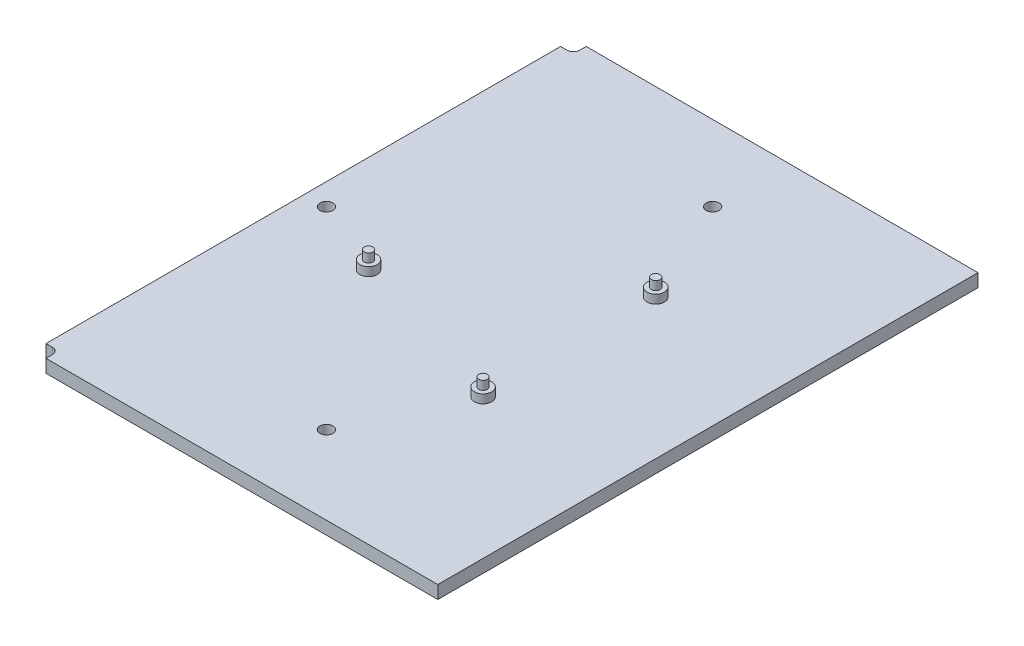
from build123d import *

# Parameters (mm, degrees)
SKETCH1_W           = 93.25
SKETCH1_H           = 124.5
BOSS_EXTRUDE1_DEPTH = 3
SKETCH2_R           = 1.45
CUT_EXTRUDE1_DEPTH  = 78.832853764
SKETCH6_R           = 2
SKETCH6_R_2         = 1
BOSS_EXTRUDE4_DEPTH = 2
SKETCH7_R           = 1
BOSS_EXTRUDE5_DEPTH = 4
SKETCH8_R           = 1.5
CUT_EXTRUDE2_DEPTH  = 3
CUT_EXTRUDE3_DEPTH  = 3
CUT_EXTRUDE4_DEPTH  = 3


with BuildPart() as part:
    # Sketch1 → Boss-Extrude1 (new body)
    with BuildSketch(Plane(origin=(0, 0, 0), x_dir=(1, 0, 0), z_dir=(0, 1, 0))):
        Rectangle(SKETCH1_W, SKETCH1_H)
    extrude(amount=BOSS_EXTRUDE1_DEPTH)

    # Sketch2 → Cut-Extrude1 (cut, through all)
    with BuildSketch(Plane(origin=(0, 3, 0), x_dir=(1, 0, 0), z_dir=(0, 1, 0))):
        with Locations(Location((-45.125, 60.75, 0), (0, 0, 270))):
            Circle(SKETCH2_R)
        with Locations(Location((-45.125, -60.75, 0), (0, 0, 270))):
            Circle(SKETCH2_R)
    extrude(amount=-CUT_EXTRUDE1_DEPTH, mode=Mode.SUBTRACT)

    # Sketch6 → Boss-Extrude4 (add)
    # profile 1 of 3: a face of its own
    with BuildSketch(Plane(origin=(0, 3, 0), x_dir=(1, 0, 0), z_dir=(0, 1, 0))):
        with Locations(Location((-24.225, -7.367286263, 0), (0, 0, 90))):
            Circle(SKETCH6_R)
        with Locations(Location((-24.225, -7.367286263, 0), (0, 0, 270))):
            Circle(SKETCH6_R_2, mode=Mode.SUBTRACT)
    # profile 2 of 3: a face of its own
    with BuildSketch(Plane(origin=(0, 3, 0), x_dir=(1, 0, 0), z_dir=(0, 1, 0))):
        with Locations(Location((14.375, 20.232713737, 0), (0, 0, 90))):
            Circle(SKETCH6_R)
        with Locations(Location((14.375, 20.232713737, 0), (0, 0, 270))):
            Circle(SKETCH6_R_2, mode=Mode.SUBTRACT)
    # profile 3 of 3: a face of its own
    with BuildSketch(Plane(origin=(0, 3, 0), x_dir=(1, 0, 0), z_dir=(0, 1, 0))):
        with Locations(Location((14.375, -19.567286263, 0), (0, 0, 90))):
            Circle(SKETCH6_R)
        with Locations(Location((14.375, -19.567286263, 0), (0, 0, 270))):
            Circle(SKETCH6_R_2, mode=Mode.SUBTRACT)
    extrude(amount=BOSS_EXTRUDE4_DEPTH)

    # Sketch7 → Boss-Extrude5 (add)
    with BuildSketch(Plane(origin=(0, 3, 0), x_dir=(1, 0, 0), z_dir=(0, 1, 0))):
        with Locations(Location((-24.225, -7.367286263, 0), (0, 0, 270))):
            Circle(SKETCH7_R)
        with Locations(Location((14.375, 20.232713737, 0), (0, 0, 270))):
            Circle(SKETCH7_R)
        with Locations(Location((14.375, -19.567286263, 0), (0, 0, 270))):
            Circle(SKETCH7_R)
    extrude(amount=BOSS_EXTRUDE5_DEPTH)

    # Sketch8 → Cut-Extrude2 (cut)
    with BuildSketch(Plane(origin=(0, 3, 0), x_dir=(1, 0, 0), z_dir=(0, 1, 0))):
        with Locations(Location((2.875, 44.832713737, 0), (0, 0, 270))):
            Circle(SKETCH8_R)
        with Locations(Location((-41.625, 0.332713737, 0), (0, 0, 270))):
            Circle(SKETCH8_R)
        with Locations(Location((2.875, -44.167286263, 0), (0, 0, 270))):
            Circle(SKETCH8_R)
    extrude(amount=-CUT_EXTRUDE2_DEPTH, mode=Mode.SUBTRACT)

    # Sketch9 → Cut-Extrude3 (cut)
    with BuildSketch(Plane(origin=(0, 3, 0), x_dir=(1, 0, 0), z_dir=(0, 1, 0))):
        with BuildLine():
            Line((-45.125, 59.3), (-46.625, 59.3))
            Line((-46.625, 59.3), (-46.625, 62.25))
            Line((-46.625, 62.25), (-43.675, 62.25))
            Line((-43.675, 62.25), (-43.675, 60.75))
            ThreePointArc((-43.675, 60.75), (-44.099695167, 59.724695167), (-45.125, 59.3))
        make_face()
    extrude(amount=-CUT_EXTRUDE3_DEPTH, mode=Mode.SUBTRACT)

    # Sketch10 → Cut-Extrude4 (cut)
    with BuildSketch(Plane(origin=(0, 3, 0), x_dir=(1, 0, 0), z_dir=(0, 1, 0))):
        with BuildLine():
            Line((-45.125, -59.3), (-46.625, -59.3))
            Line((-46.625, -59.3), (-46.625, -62.25))
            Line((-46.625, -62.25), (-43.675, -62.25))
            Line((-43.675, -62.25), (-43.675, -60.75))
            ThreePointArc((-43.675, -60.75), (-44.099695167, -59.724695167), (-45.125, -59.3))
        make_face()
    extrude(amount=-CUT_EXTRUDE4_DEPTH, mode=Mode.SUBTRACT)


solid = part.part
